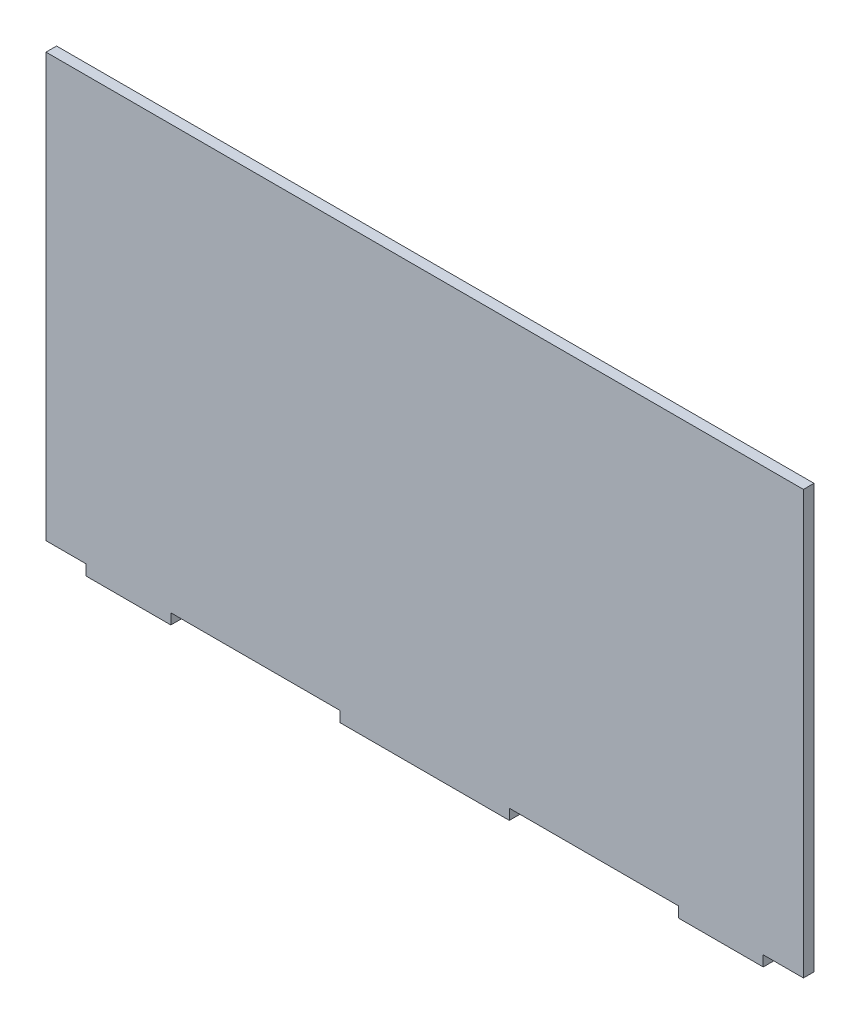
from build123d import *

# Parameters (mm, degrees)
BOSS_EXTRU_1_DEPTH = 5


with BuildPart() as part:
    # Esquisse1 → Boss.-Extru.1 (new body)
    with BuildSketch(Plane.XY):
        Polygon((-10.898625834, 0.816744863), (8.101374166, 0.816744863), (8.101374166, -4.183255137), (48.101374166, -4.183255137), (48.101374166, 0.816744863), (128.101374166, 0.816744863), (128.101374166, -4.183255137), (208.101374166, -4.183255137), (208.101374166, 0.816744863), (288.101374166, 0.816744863), (288.101374166, -4.183255137), (328.101374166, -4.183255137), (328.101374166, 0.816744863), (347.101374166, 0.816744863), (347.101374166, 200.816744863), (-10.898625834, 200.816744863), align=None)
    extrude(amount=BOSS_EXTRU_1_DEPTH)


solid = part.part
